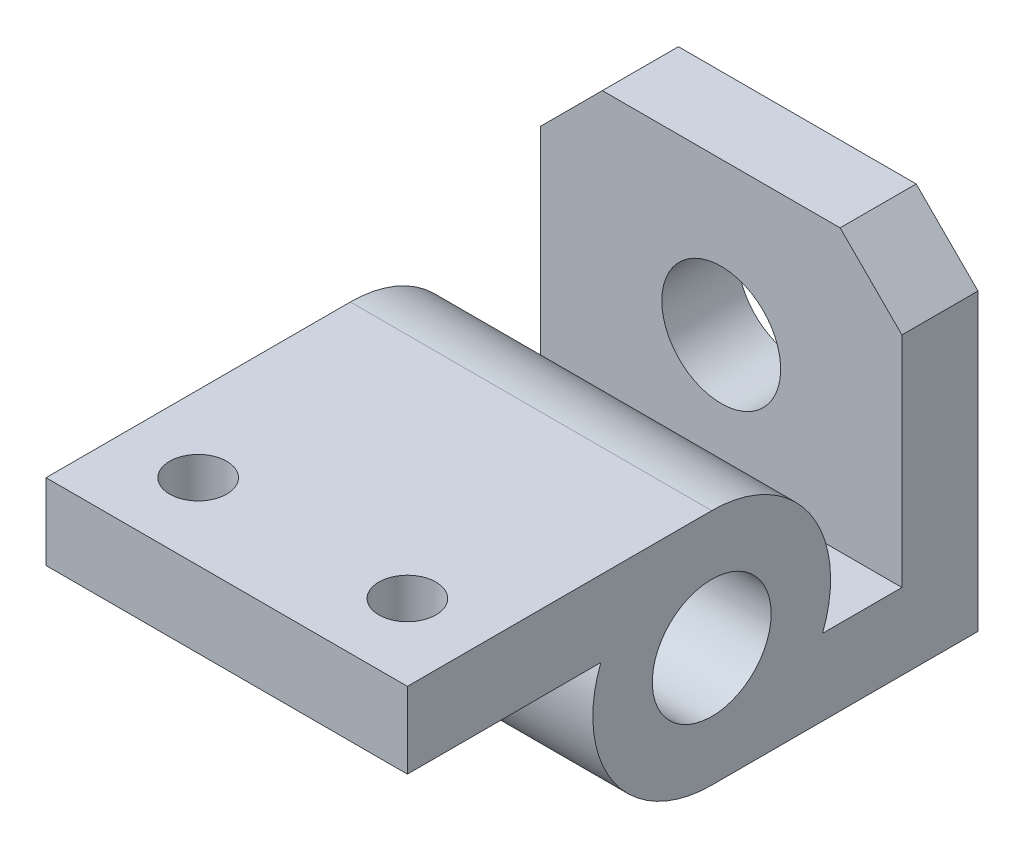
from build123d import *

# Parameters (mm, degrees)
SKETCH1_R           = 12.5
BOSS_EXTRUDE1_DEPTH = 38
SKETCH2_R           = 6
CUT_EXTRUDE1_DEPTH  = 76
CUT_EXTRUDE2_REACH  = 137.44
SKETCH3_R           = 12.5
CHAMFER1_SIZE       = 13


with BuildPart() as part:
    # Sketch1 → Boss-Extrude1 (new, symmetric)
    with BuildSketch(Plane(origin=(0, 0, 0), x_dir=(0, 0, -1), z_dir=(1, 0, 0))):
        with BuildLine():
            Line((0, 25), (-64, 25))
            Line((-64, 25), (-64, 9))
            Line((-64, 9), (-23.323807579, 9))
            ThreePointArc((-23.323807579, 9), (-20.615528128, -14.142135624), (0, -25))
            Line((0, -25), (56, -25))
            Line((56, -25), (56, 50))
            Line((56, 50), (40, 50))
            Line((40, 50), (40, -9))
            Line((40, -9), (23.323807579, -9))
            ThreePointArc((23.323807579, -9), (20.615528128, 14.142135624), (0, 25))
        make_face()
        Circle(SKETCH1_R, mode=Mode.SUBTRACT)
    extrude(amount=BOSS_EXTRUDE1_DEPTH, both=True)

    # Sketch2 → Cut-Extrude1 (cut)
    with BuildSketch(Plane(origin=(0, 25, 0), x_dir=(1, 0, 0), z_dir=(0, 1, 0))):
        with Locations(Location((-22, -48, 0), (0, 0, 270))):
            Circle(SKETCH2_R)
        with Locations(Location((22, -48, 0), (0, 0, 270))):
            Circle(SKETCH2_R)
    extrude(amount=-CUT_EXTRUDE1_DEPTH, mode=Mode.SUBTRACT)

    # Sketch3 → Cut-Extrude2 (cut, up to next)
    with BuildSketch(Plane(origin=(0, 0, -56), x_dir=(-1, 0, 0), z_dir=(0, 0, -1)), mode=Mode.PRIVATE) as cut_extrude2_sk1:
        with Locations((0, 18)):
            Circle(SKETCH3_R)
    cut_extrude2_tool1 = extrude(cut_extrude2_sk1.sketch, amount=-CUT_EXTRUDE2_REACH, mode=Mode.PRIVATE) & part.part
    add(cut_extrude2_tool1.solids().sort_by_distance((0, 18, -56))[0], mode=Mode.SUBTRACT)

    # Chamfer1
    chamfer1_edges = [part.edges().sort_by_distance(p)[0] for p in [
        (-38, 50, -48),
        (38, 50, -48),
    ]]
    chamfer(chamfer1_edges, length=CHAMFER1_SIZE)


solid = part.part
